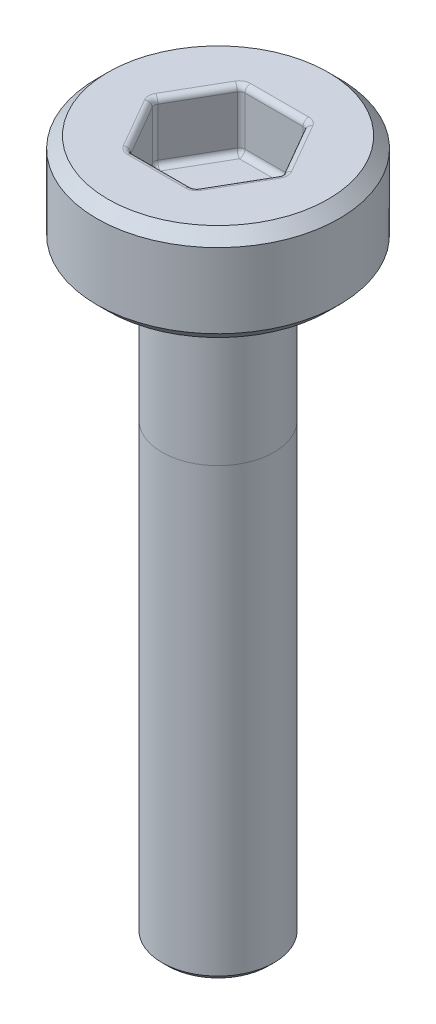
from build123d import *

# Parameters (mm, degrees)
SKETCH1_R           = 0.75
BOSS_EXTRUDE1_DEPTH = 8
SKETCH2_R           = 1.625
BOSS_EXTRUDE2_DEPTH = 1.3
FILLET1_R           = 0.15
CHAMFER1_SIZE       = 0.15
CUT_EXTRUDE1_DEPTH  = 0.8
CHAMFER2_SIZE       = 0.075
FILLET2_R           = 0.075


with BuildPart() as part:
    # Sketch1 → Boss-Extrude1 (new body)
    with BuildSketch(Plane(origin=(0, 0, 0), x_dir=(1, 0, 0), z_dir=(0, 1, 0))):
        with Locations(Location((0, 0, 0), (0, 0, 270))):
            Circle(SKETCH1_R)
    extrude(amount=BOSS_EXTRUDE1_DEPTH)

    # Sketch2 → Boss-Extrude2 (add)
    with BuildSketch(Plane(origin=(0, 8, 0), x_dir=(1, 0, 0), z_dir=(0, 1, 0))):
        with Locations(Location((0, 0, 0), (0, 0, 270))):
            Circle(SKETCH2_R)
    extrude(amount=BOSS_EXTRUDE2_DEPTH)

    # Fillet1
    fillet1_edges = [part.edges().sort_by_distance(p)[0] for p in [
        (0, 8, -0.75),
    ]]
    fillet(fillet1_edges, radius=FILLET1_R)

    # Chamfer1
    chamfer1_edges = [part.edges().sort_by_distance(p)[0] for p in [
        (0, 8, -1.625),
        (0, 9.3, -1.625),
    ]]
    chamfer(chamfer1_edges, length=CHAMFER1_SIZE)

    # Sketch3 → Cut-Extrude1 (cut)
    with BuildSketch(Plane(origin=(0, 9.3, 0), x_dir=(1, 0, 0), z_dir=(0, 1, 0))):
        Polygon((-0.433012702, 0.75), (-0.866025404, 0), (-0.433012702, -0.75), (0.433012702, -0.75), (0.866025404, 0), (0.433012702, 0.75), align=None)
    extrude(amount=-CUT_EXTRUDE1_DEPTH, mode=Mode.SUBTRACT)

    # Chamfer2
    chamfer2_edges = [part.edges().sort_by_distance(p)[0] for p in [
        (0, 0, -0.75),
    ]]
    chamfer(chamfer2_edges, length=CHAMFER2_SIZE)

    # Fillet2
    fillet2_edges = [part.edges().sort_by_distance(p)[0] for p in [
        (0, 8.5, -0.75),
        (-0.433012702, 8.9, -0.75),
        (0.649519053, 8.5, -0.375),
        (0.433012702, 8.9, -0.75),
        (0.649519053, 8.5, 0.375),
        (0.866025404, 8.9, 0),
        (0, 8.5, 0.75),
        (0.433012702, 8.9, 0.75),
        (-0.649519053, 8.5, 0.375),
        (-0.433012702, 8.9, 0.75),
        (-0.649519053, 8.5, -0.375),
        (-0.866025404, 8.9, 0),
        (0, 9.3, -0.75),
        (-0.649519053, 9.3, -0.375),
        (-0.649519053, 9.3, 0.375),
        (0, 9.3, 0.75),
        (0.649519053, 9.3, 0.375),
        (0.649519053, 9.3, -0.375),
    ]]
    fillet(fillet2_edges, radius=FILLET2_R)


solid = part.part
